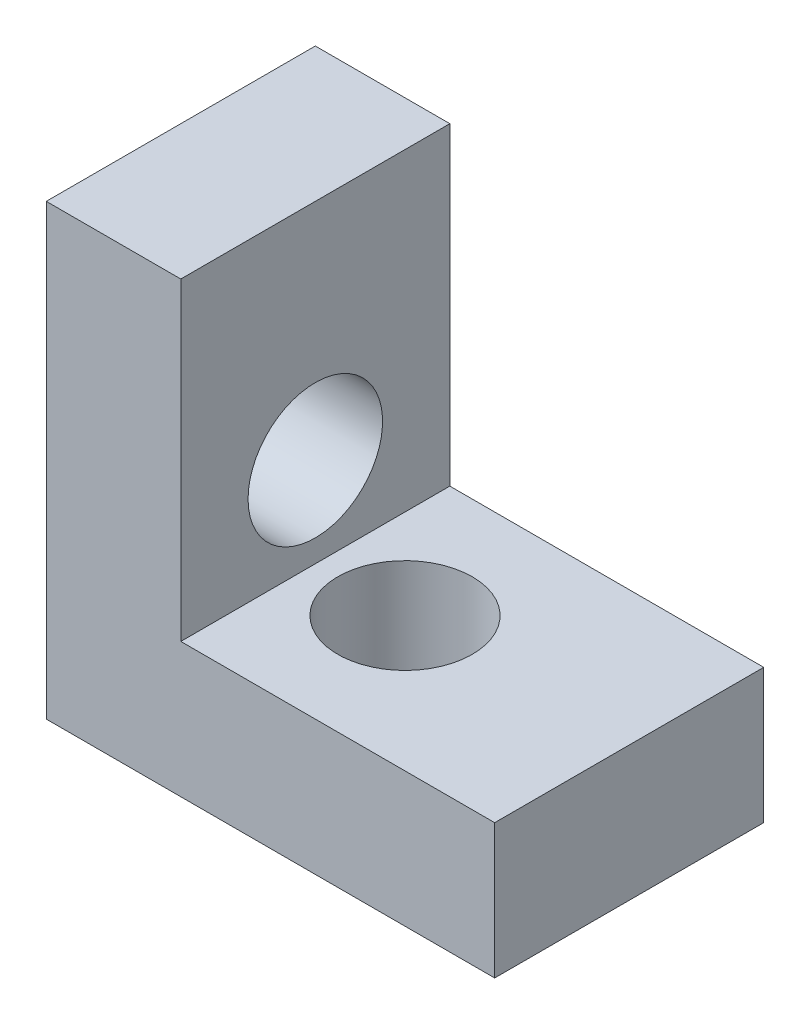
from build123d import *

# Parameters (mm, degrees)
SKETCH_1_W          = 10
SKETCH_1_H          = 6
EXTRUDE_1_DEPTH     = 3
SKETCH_2_W          = 3
SKETCH_2_H          = 6
EXTRUDE_2_DEPTH     = 7
SKETCH_3_R          = 1.5
CUT_EXTRUDE_2_DEPTH = 3
SKETCH_4_R          = 1.5
CUT_EXTRUDE_3_DEPTH = 3


with BuildPart() as part:
    # 草图1 → 凸台-拉伸1 (new body)
    with BuildSketch(Plane(origin=(0, 0, 0), x_dir=(1, 0, 0), z_dir=(0, 1, 0))):
        Rectangle(SKETCH_1_W, SKETCH_1_H)
    extrude(amount=EXTRUDE_1_DEPTH)

    # 草图2 → 凸台-拉伸2 (add)
    with BuildSketch(Plane(origin=(0, 3, 0), x_dir=(1, 0, 0), z_dir=(0, 1, 0))):
        with Locations((-3.5, 0)):
            Rectangle(SKETCH_2_W, SKETCH_2_H)
    extrude(amount=EXTRUDE_2_DEPTH)

    # 草图3 → 切除-拉伸2 (cut)
    with BuildSketch(Plane.XZ):
        with Locations(Location((0, 0, 0), (0, 0, 270))):
            Circle(SKETCH_3_R)
    extrude(amount=-CUT_EXTRUDE_2_DEPTH, mode=Mode.SUBTRACT)

    # 草图4 → 切除-拉伸3 (cut)
    with BuildSketch(Plane.ZY.offset(5)):
        with Locations((0, 5)):
            Circle(SKETCH_4_R)
    extrude(amount=-CUT_EXTRUDE_3_DEPTH, mode=Mode.SUBTRACT)


solid = part.part
